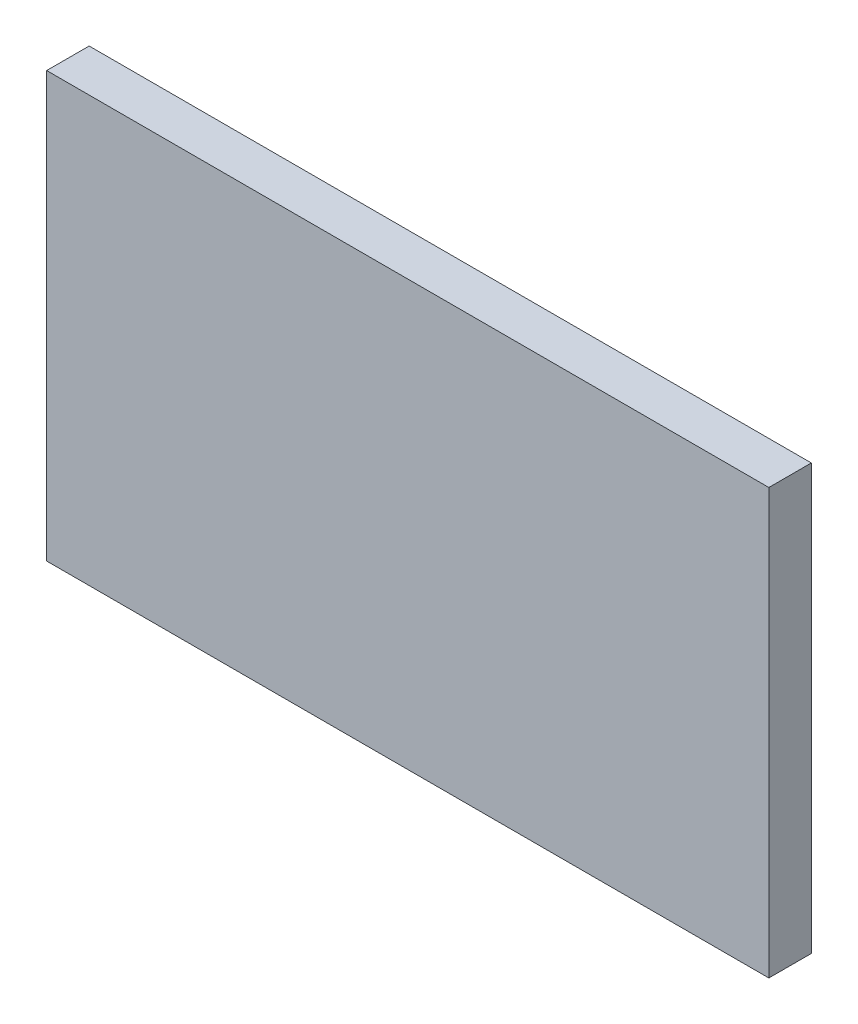
from build123d import *

# Parameters (mm, degrees)
ESQUISSE1_W        = 102
ESQUISSE1_H        = 60
BOSS_EXTRU_1_DEPTH = 6


with BuildPart() as part:
    # Esquisse1 → Boss.-Extru.1 (new body)
    with BuildSketch(Plane.XY):
        with Locations((-51, 30)):
            Rectangle(ESQUISSE1_W, ESQUISSE1_H)
    extrude(amount=BOSS_EXTRU_1_DEPTH)


solid = part.part
